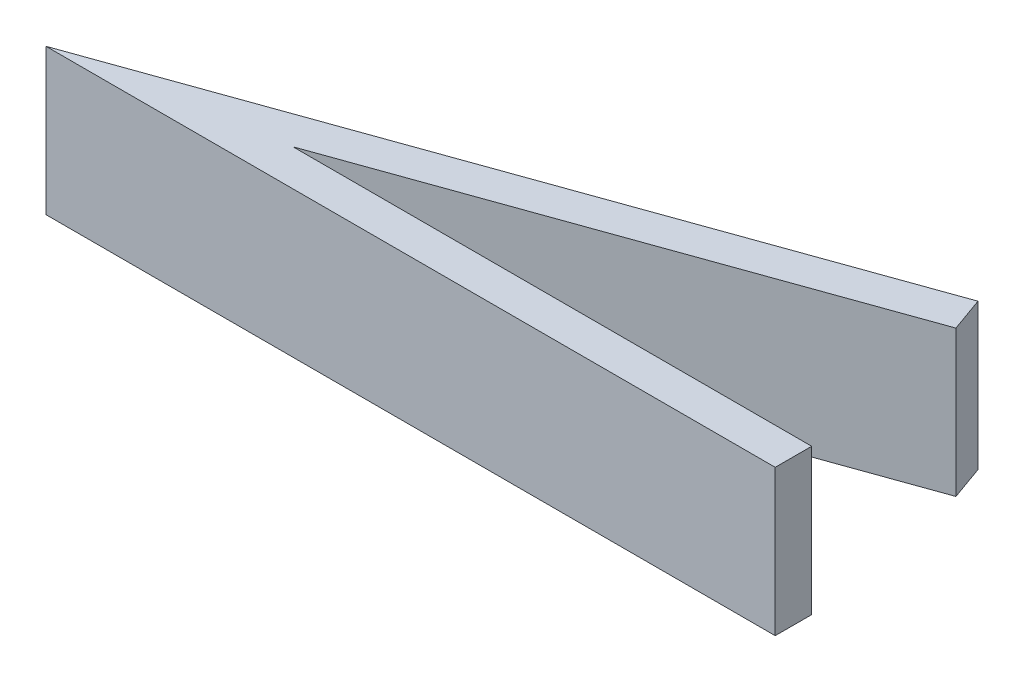
from build123d import *

# Parameters (mm, degrees)
BOSS_EXTRUDE1_DEPTH = 20


with BuildPart() as part:
    # Sketch1 → Boss-Extrude1 (new body)
    with BuildSketch(Plane(origin=(0, 0, 0), x_dir=(1, 0, 0), z_dir=(0, 1, 0))):
        Polygon((0, 0), (62.679677005, 0), (62.679677005, 5), (-8.454254311, 5), (58.535550128, 28.924930212), (56.85386814, 33.633639769), (-37.320322995, 0), align=None)
    extrude(amount=BOSS_EXTRUDE1_DEPTH)


solid = part.part
